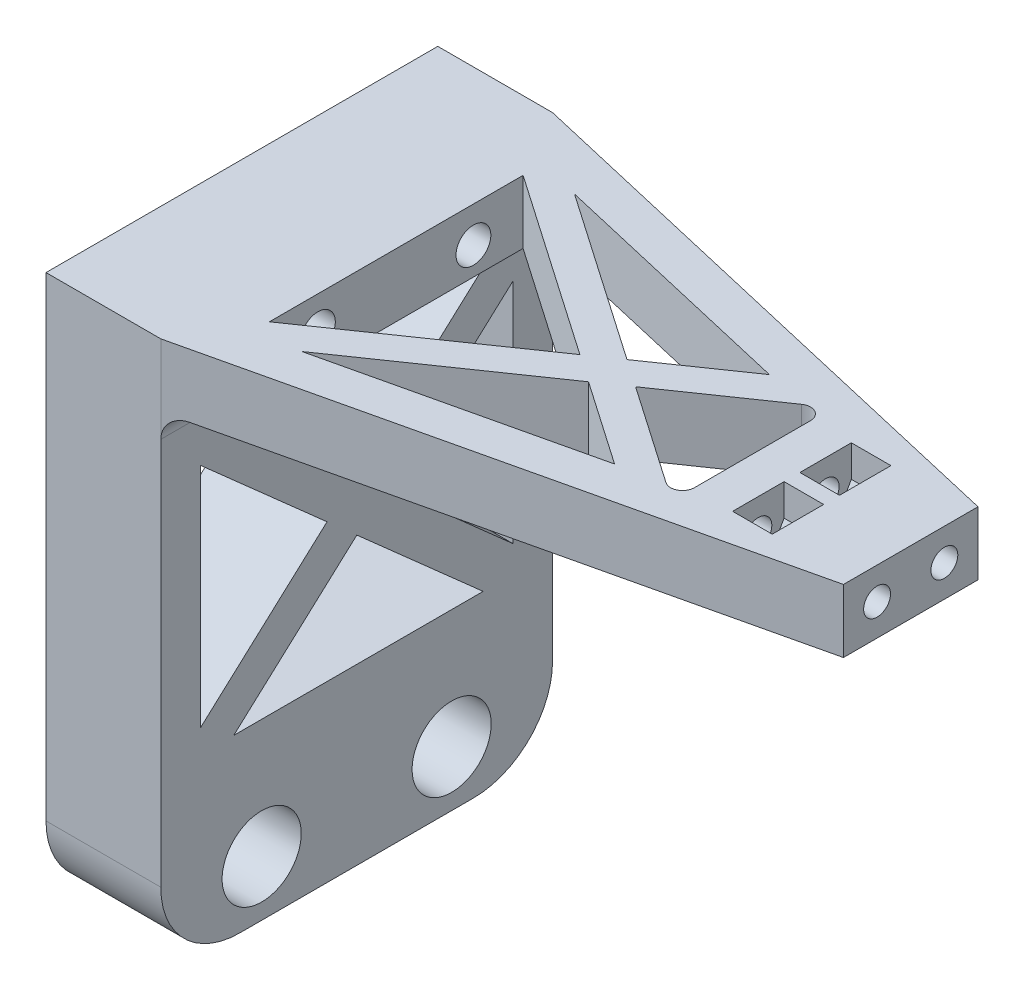
from build123d import *

# Parameters (mm, degrees)
SKETCH1_W           = 14.5
SKETCH1_H           = 49.5
BOSS_EXTRUDE1_DEPTH = 70
FILLET1_R           = 10
SKETCH2_R           = 5
CUT_EXTRUDE1_DEPTH  = 76.649272964
BOSS_EXTRUDE2_DEPTH = 8
SKETCH5_R           = 1.7
CUT_EXTRUDE2_DEPTH  = 15
CUT_EXTRUDE3_DEPTH  = 5
CUT_EXTRUDE4_DEPTH  = 103.041964407
CUT_EXTRUDE5_DEPTH  = 10
FILLET2_R           = 1.5
FILLET3_R           = 3
SKETCH10_R          = 2.2
CUT_EXTRUDE6_DEPTH  = 19.5
SKETCH11_R          = 1.7
CUT_EXTRUDE7_DEPTH  = 3


with BuildPart() as part:
    # Sketch1 → Boss-Extrude1 (new body)
    with BuildSketch(Plane(origin=(0, 0, 0), x_dir=(1, 0, 0), z_dir=(0, 1, 0))):
        Rectangle(SKETCH1_W, SKETCH1_H)
    extrude(amount=BOSS_EXTRUDE1_DEPTH)

    # Fillet1
    fillet1_edges = [part.edges().sort_by_distance(p)[0] for p in [
        (0, 0, 24.75),
        (0, 0, -24.75),
    ]]
    fillet(fillet1_edges, radius=FILLET1_R)

    # Sketch2 → Cut-Extrude1 (cut, through all)
    with BuildSketch(Plane(origin=(7.25, 0, 0), x_dir=(0, 0, -1), z_dir=(1, 0, 0))):
        with Locations((-12, 7)):
            Circle(SKETCH2_R)
        with Locations(Location((12, 7, 0), (0, 0, 180))):
            Circle(SKETCH2_R)
    extrude(amount=-CUT_EXTRUDE1_DEPTH, mode=Mode.SUBTRACT)

    # Sketch3 → Boss-Extrude2 (add)
    with BuildSketch(Plane(origin=(0, 70, 0), x_dir=(1, 0, 0), z_dir=(0, 1, 0))):
        Polygon((77.25, 8.5), (77.25, -8.5), (7.25, -24.75), (7.25, 24.75), align=None)
    extrude(amount=-BOSS_EXTRUDE2_DEPTH)

    # Sketch5 → Cut-Extrude2 (cut)
    with BuildSketch(Plane(origin=(77.25, 0, 0), x_dir=(0, 0, -1), z_dir=(1, 0, 0))):
        with Locations((-4.25, 66)):
            Circle(SKETCH5_R)
        with Locations((4.25, 66)):
            Circle(SKETCH5_R)
    extrude(amount=-CUT_EXTRUDE2_DEPTH, mode=Mode.SUBTRACT)

    # Sketch7 → Cut-Extrude3 (cut)
    with BuildSketch(Plane(origin=(62.25, 0, 0), x_dir=(0, 0, -1), z_dir=(1, 0, 0))):
        Polygon((-7.5, 66), (-7.5, 70), (-1, 70), (-1, 66), (-2.625, 63.185417438), (-5.875, 63.185417438), align=None)
        Polygon((1, 66), (2.625, 63.185417438), (5.875, 63.185417438), (7.5, 66), (7.5, 70), (1, 70), align=None)
    extrude(amount=CUT_EXTRUDE3_DEPTH, mode=Mode.SUBTRACT)

    # Sketch8 → Cut-Extrude4 (cut, through all)
    with BuildSketch(Plane(origin=(7.25, 0, 0), x_dir=(0, 0, -1), z_dir=(1, 0, 0))):
        Polygon((0.021408878, 36.140810628), (15.98032373, 22), (-15.533482813, 22), align=None)
        Polygon((-19.75, 24.924106533), (-19.75, 53.65978052), (-3.742755965, 39.476146565), align=None)
        Polygon((-15.98032373, 57), (15.533482813, 57), (-0.021408878, 42.859189372), align=None)
        Polygon((19.75, 25.34021948), (19.75, 54.075893467), (3.742755965, 39.523853435), align=None)
    extrude(amount=-CUT_EXTRUDE4_DEPTH, mode=Mode.SUBTRACT)

    # Sketch9 → Cut-Extrude5 (cut)
    with BuildSketch(Plane(origin=(0, 70, 0), x_dir=(1, 0, 0), z_dir=(0, 1, 0))):
        Polygon((35.452952842, 0), (12.25, -16.025665333), (12.25, 16.025665333), align=None)
        Polygon((49.616038971, 9.782068685), (17.550981037, 17.225742848), (38.972216713, 2.430662399), align=None)
        Polygon((57.25, 10.193318694), (42.491480584, 0), (57.25, -10.193318694), align=None)
        Polygon((38.972216713, -2.430662399), (49.616038971, -9.782068685), (17.550981037, -17.225742848), align=None)
    extrude(amount=-CUT_EXTRUDE5_DEPTH, mode=Mode.SUBTRACT)

    # Fillet2
    fillet2_edges = [part.edges().sort_by_distance(p)[0] for p in [
        (57.25, 66, -10.193318694),
        (57.25, 66, 10.193318694),
    ]]
    fillet(fillet2_edges, radius=FILLET2_R)

    # Fillet3
    fillet3_edges = [part.edges().sort_by_distance(p)[0] for p in [
        (7.25, 62, 0),
    ]]
    fillet(fillet3_edges, radius=FILLET3_R)

    # Sketch10 → Cut-Extrude6 (cut)
    with BuildSketch(Plane.ZY.offset(7.25)):
        with Locations((-9.75, 65.5)):
            Circle(SKETCH10_R)
        with Locations((9.898872111, 65.837689232)):
            Circle(SKETCH10_R)
    extrude(amount=-CUT_EXTRUDE6_DEPTH, mode=Mode.SUBTRACT)

    # Sketch11 → Cut-Extrude7 (cut)
    with BuildSketch(Plane(origin=(62.25, 0, 0), x_dir=(0, 0, -1), z_dir=(1, 0, 0))):
        with Locations((4.25, 66)):
            Circle(SKETCH11_R)
        with Locations((-4.25, 66)):
            Circle(SKETCH11_R)
    extrude(amount=-CUT_EXTRUDE7_DEPTH, mode=Mode.SUBTRACT)


solid = part.part
